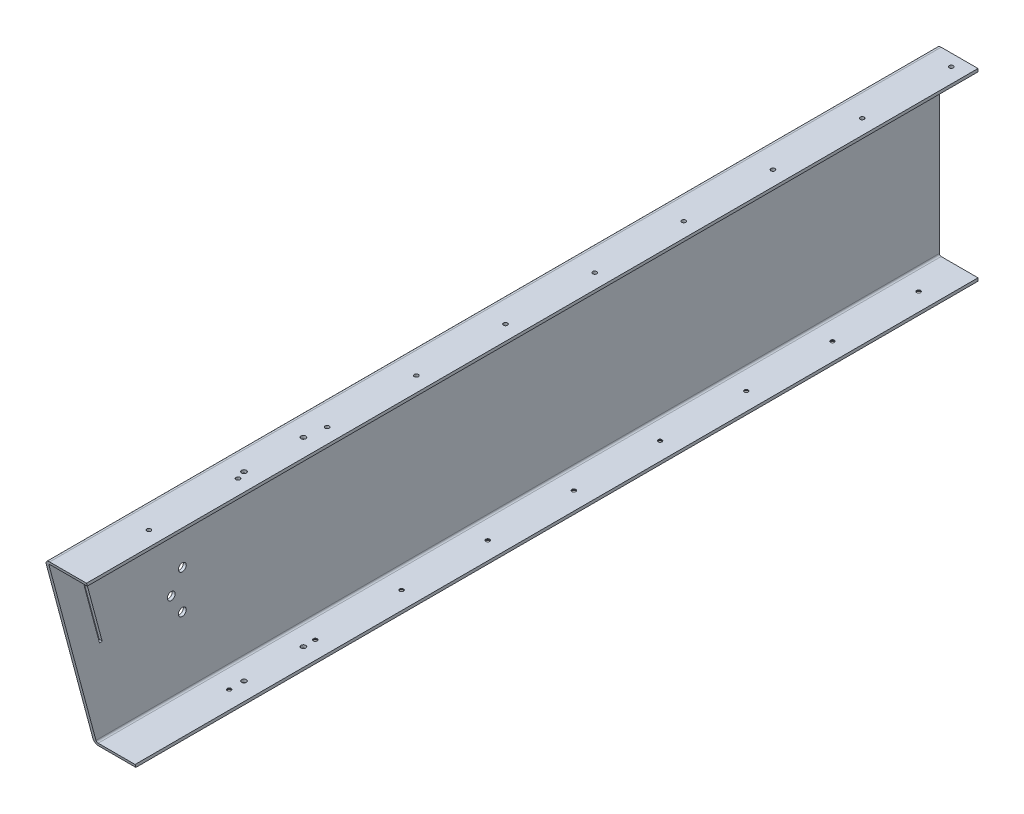
from build123d import *

# Parameters (mm, degrees)
EXTRUDE_1_DEPTH             = 1500
CUT_EXTRUDE_874_DEPTH       = 1510.610877014
SKETCH_4_R                  = 6.6
CUT_EXTRUDE_1154_DEPTH      = 1510.387292911
CUT_EXTRUDE_3058_DEPTH      = 1510.610877014
CUT_EXTRUDE_3058_DEPTH_BACK = 1510.610877014
CUT_EXTRUDE_6_DEPTH         = 1534.297101021
CUT_EXTRUDE_6_DEPTH_BACK    = 1534.297101021
SKETCH_19_R                 = 4
PATTERN_LINEAR_1_COUNT      = 9
PATTERN_LINEAR_1_PITCH      = 145
PATTERN_LINEAR_2_COUNT      = 10
PATTERN_LINEAR_2_PITCH      = 150


with BuildPart() as part:
    # Эскиз1 → Бобышка-Вытянуть1 (new body)
    with BuildSketch(Plane.XY):
        with BuildLine():
            Line((70, -155), (8, -155))
            ThreePointArc((8, -155), (2.343145751, -152.656854249), (0, -147))
            Line((0, -147), (0, 147))
            ThreePointArc((0, 147), (2.343145751, 152.656854249), (8, 155))
            Line((8, 155), (70, 155))
            Line((70, 155), (70, 150))
            Line((70, 150), (8, 150))
            ThreePointArc((8, 150), (5.878679656, 149.121320344), (5, 147))
            Line((5, 147), (5, -147))
            ThreePointArc((5, -147), (5.878679656, -149.121320344), (8, -150))
            Line((8, -150), (70, -150))
            Line((70, -150), (70, -155))
        make_face()
    extrude(amount=EXTRUDE_1_DEPTH)

    # Эскиз2 → Cut-Extrude 874 (cut, through all)
    with BuildSketch(Plane.ZY):
        Polygon((1500, 155), (1416.935750346, -155), (1500, -155), align=None)
    extrude(amount=-CUT_EXTRUDE_874_DEPTH, mode=Mode.SUBTRACT)

    # Эскиз4 → Cut-Extrude 1154 (cut, through all)
    with BuildSketch(Plane(origin=(5, 0, 0), x_dir=(0, 0, -1), z_dir=(1, 0, 0))):
        with Locations(Location((-1292.5, 0, 0), (0, 0, 90))):
            Circle(SKETCH_4_R)
        with Locations(Location((-1273.75, 32.475952642, 0), (0, 0, 90))):
            Circle(SKETCH_4_R)
        with Locations(Location((-1273.75, -32.475952642, 0), (0, 0, 90))):
            Circle(SKETCH_4_R)
    extrude(amount=-CUT_EXTRUDE_1154_DEPTH, mode=Mode.SUBTRACT)

    # Эскиз7 → Зенковка для винта с потайной головкой и внутренним шестигранником M61 (revolve, cut)
    with BuildSketch(Plane(origin=(40, -155, 1229.935750346), x_dir=(0, 0, -1), z_dir=(1, 0, 0))):
        Polygon((0, 0), (0, 31.982840043), (3.3, 30), (3.3, 3.555), (6.855, 0), align=None)
    hole_wizard_m61 = revolve(axis=Axis((40, -161.35, 1229.935750346), (0, 1, 0)), mode=Mode.SUBTRACT)

    # Эскиз16 → Cut-Extrude 3058 (cut, two sides: drawn at the far end of the back side and taken through both)
    with BuildSketch(Plane.ZY.offset(-CUT_EXTRUDE_3058_DEPTH_BACK)):
        Polygon((1434.702880481, 89.617739901), (1408.717448353, -7.361213059), (1412.967521989, -8.500016857), (1438.952954117, 88.478936102), align=None)
    extrude(amount=CUT_EXTRUDE_3058_DEPTH + CUT_EXTRUDE_3058_DEPTH_BACK, mode=Mode.SUBTRACT)

    # Эскиз19 → Вырез-Вытянуть6 (cut, two sides: drawn at the far end of the back side and taken through both)
    with BuildSketch(Plane(origin=(0, 155, 0), x_dir=(1, 0, 0), z_dir=(0, 1, 0)).offset(-CUT_EXTRUDE_6_DEPTH_BACK)):
        with Locations(Location((40, -1205, 0), (0, 0, 270))):
            Circle(SKETCH_19_R)
        with Locations(Location((40, -1105, 0), (0, 0, 270))):
            Circle(SKETCH_19_R)
    extrude(amount=CUT_EXTRUDE_6_DEPTH + CUT_EXTRUDE_6_DEPTH_BACK, mode=Mode.SUBTRACT)

    # Линейный массив1: Зенковка для винта с потайной головкой и внутренним шестигранником M61 ×9
    with Locations(*[(0, 0, -i * PATTERN_LINEAR_1_PITCH) for i in range(1, PATTERN_LINEAR_1_COUNT)]):
        add(hole_wizard_m61, mode=Mode.SUBTRACT)

    # Эскиз26 → Отверстие обработанное метчиком M82 (revolve, cut)
    with BuildSketch(Plane(origin=(45, 155, 1370), x_dir=(0, 0, 1), z_dir=(1, 0, 0))):
        Polygon((0, 0), (0, 24.292926105), (3.4, 22.25), (3.4, 0), align=None)
    hole_wizard_m82 = revolve(axis=Axis((45, 161.35, 1370), (0, -1, 0)), mode=Mode.SUBTRACT)

    # Линейный массив2: Отверстие обработанное метчиком M82 ×10
    with Locations(*[(0, 0, -i * PATTERN_LINEAR_2_PITCH) for i in range(1, PATTERN_LINEAR_2_COUNT)]):
        add(hole_wizard_m82, mode=Mode.SUBTRACT)


solid = part.part
